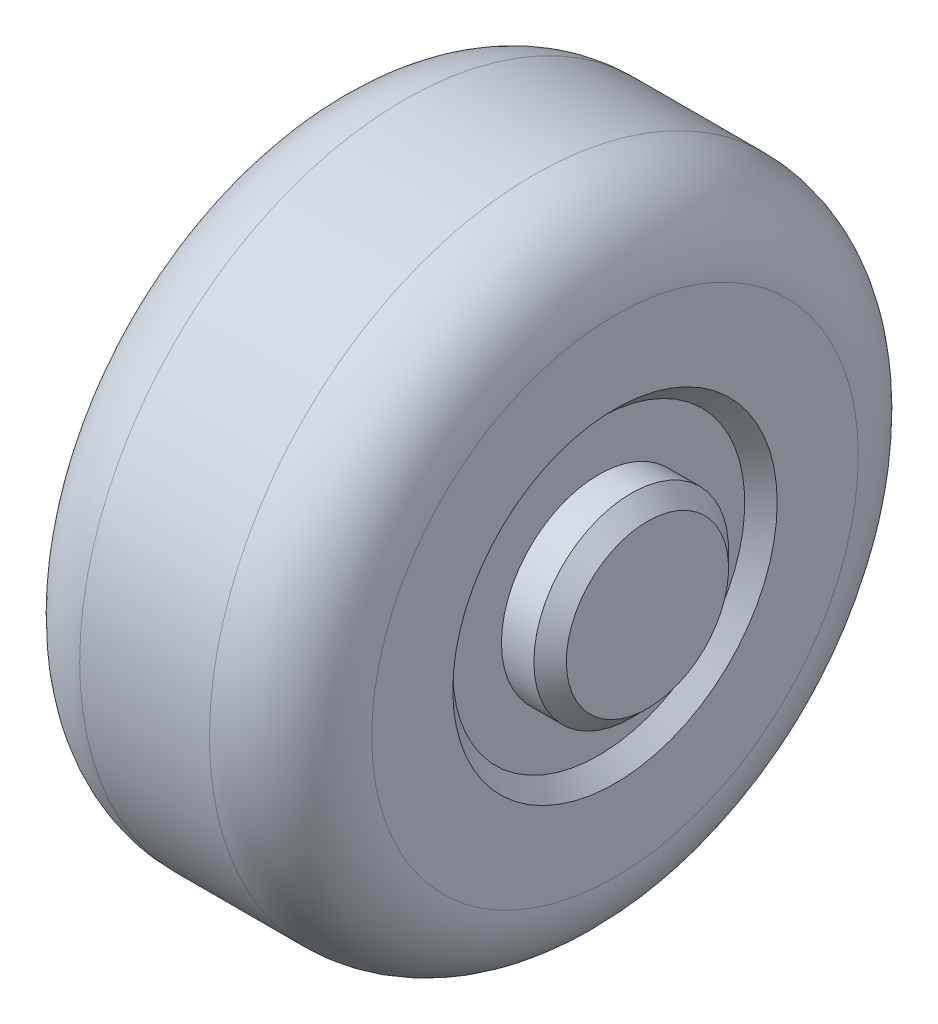
from build123d import *


with BuildPart() as part:
    # 草图1 → 旋转1 (revolve)
    with BuildSketch(Plane.XY):
        with BuildLine():
            Line((-11, 0), (-11, 5))
            Line((-11, 5), (-10, 6))
            Line((-10, 6), (-8, 6))
            Line((-8, 6), (-8, 9))
            Line((-8, 9), (-9, 10))
            Line((-9, 10), (-9, 15))
            ThreePointArc((-9, 15), (-7.535533906, 18.535533906), (-4, 20))
            Line((-4, 20), (4, 20))
            ThreePointArc((4, 20), (7.535533906, 18.535533906), (9, 15))
            Line((9, 15), (9, 10))
            Line((9, 10), (8, 9))
            Line((8, 9), (8, 6))
            Line((8, 6), (10, 6))
            Line((10, 6), (11, 5))
            Line((11, 5), (11, 0))
            Line((11, 0), (-11, 0))
        make_face()
    revolve(axis=Axis((11, 0, 0), (-1, 0, 0)))


solid = part.part
